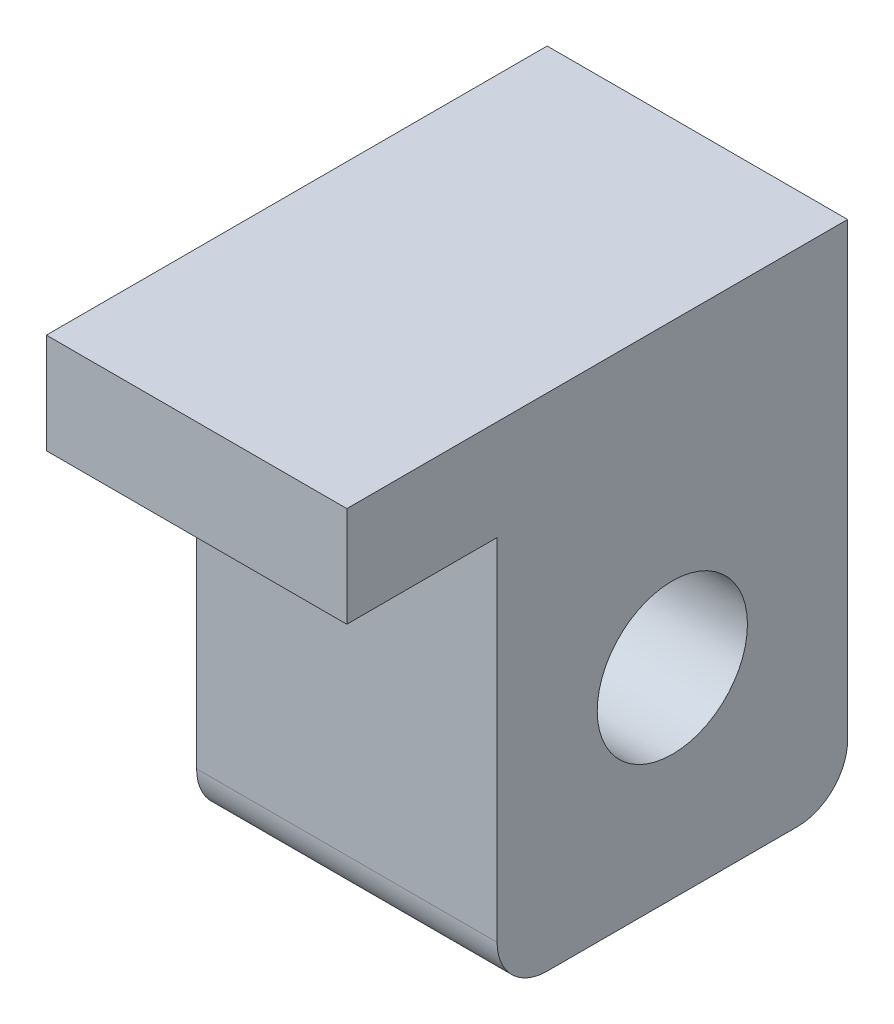
from build123d import *

# Parameters (mm, degrees)
SKETCH_2_W               = 35
SKETCH_2_H               = 50
EXTRUDE_1_DEPTH          = 30
CUT_EXTRUDE_1_DEPTH      = 43.793106922
CUT_EXTRUDE_1_DEPTH_BACK = 43.793106922
SKETCH_3_R               = 7.5
FILLET_1_R               = 5
FILLET_2_R               = 5
SKETCH_4_R               = 2.75
CUT_EXTRUDE_2_DEPTH      = 20
SKETCH_5_W               = 30
SKETCH_5_H               = 15
EXTRUDE_2_DEPTH          = 10


with BuildPart() as part:
    # 草图2 → 凸台-拉伸1 (new body)
    with BuildSketch(Plane(origin=(0, 0, 0), x_dir=(0, 0, -1), z_dir=(1, 0, 0))):
        Rectangle(SKETCH_2_W, SKETCH_2_H)
    extrude(amount=EXTRUDE_1_DEPTH)

    # 草图3 → 切除-拉伸1 (cut, two sides: drawn at the far end of the back side and taken through both)
    with BuildSketch(Plane(origin=(30, 0, 0), x_dir=(0, 0, -1), z_dir=(1, 0, 0)).offset(-CUT_EXTRUDE_1_DEPTH_BACK)):
        with Locations((0, -5)):
            Circle(SKETCH_3_R)
    extrude(amount=CUT_EXTRUDE_1_DEPTH + CUT_EXTRUDE_1_DEPTH_BACK, mode=Mode.SUBTRACT)

    # 圆角1
    fillet_1_edges = [part.edges().sort_by_distance(p)[0] for p in [
        (15, -25, -17.5),
    ]]
    fillet(fillet_1_edges, radius=FILLET_1_R)

    # 圆角2
    fillet_2_edges = [part.edges().sort_by_distance(p)[0] for p in [
        (15, -25, 17.5),
    ]]
    fillet(fillet_2_edges, radius=FILLET_2_R)

    # 草图4 → 切除-拉伸2 (cut)
    with BuildSketch(Plane.ZY):
        with Locations((11.313708499, 6.313708499)):
            Circle(SKETCH_4_R)
        with Locations((-11.313708499, 6.313708499)):
            Circle(SKETCH_4_R)
        with Locations((-11.313708499, -16.313708499)):
            Circle(SKETCH_4_R)
        with Locations((11.313708499, -16.313708499)):
            Circle(SKETCH_4_R)
    extrude(amount=-CUT_EXTRUDE_2_DEPTH, mode=Mode.SUBTRACT)

    # 草图5 → 凸台-拉伸2 (add)
    with BuildSketch(Plane(origin=(0, 25, 0), x_dir=(1, 0, 0), z_dir=(0, 1, 0))):
        with Locations((15, -25)):
            Rectangle(SKETCH_5_W, SKETCH_5_H)
    extrude(amount=-EXTRUDE_2_DEPTH)


solid = part.part
